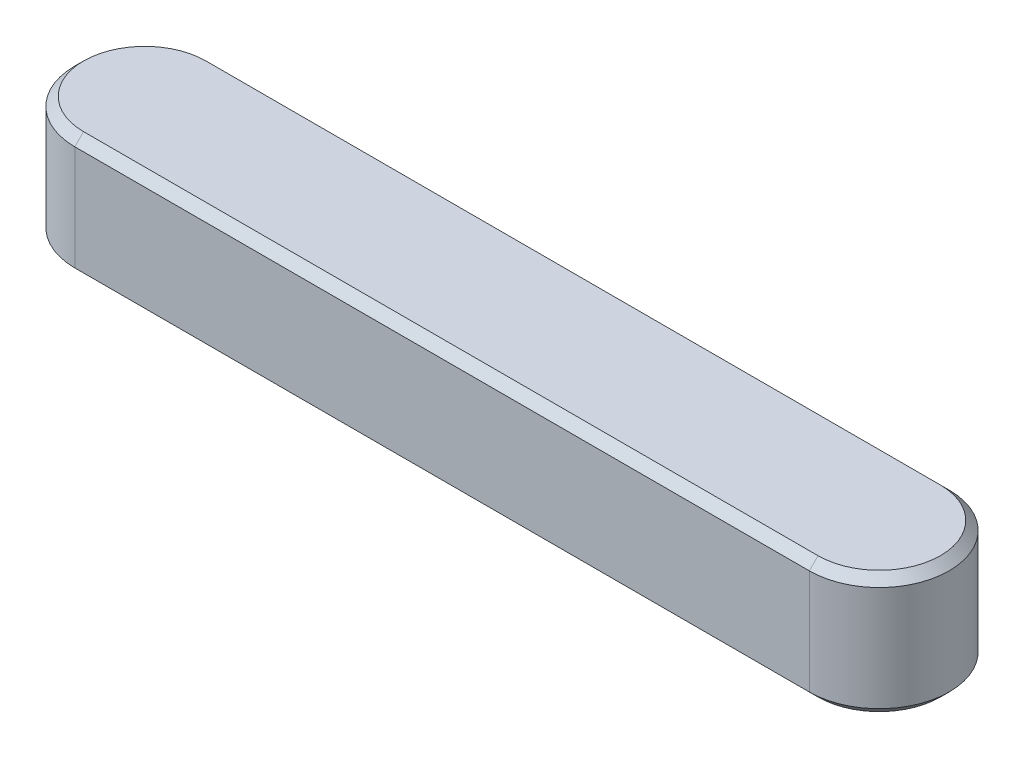
from build123d import *

# Parameters (mm, degrees)
BOSS_EXTRUDE1_DEPTH = 7
CHAMFER1_SIZE       = 0.5


with BuildPart() as part:
    # Sketch1 → Boss-Extrude1 (new body)
    with BuildSketch(Plane(origin=(0, 0, 0), x_dir=(1, 0, 0), z_dir=(0, 1, 0))):
        with BuildLine():
            Line((-21, 4), (21, 4))
            ThreePointArc((21, 4), (25, 0), (21, -4))
            Line((21, -4), (-21, -4))
            ThreePointArc((-21, -4), (-25, 0), (-21, 4))
        make_face()
    extrude(amount=BOSS_EXTRUDE1_DEPTH)

    # Chamfer1
    chamfer1_edges = [part.edges().sort_by_distance(p)[0] for p in [
        (25, 7, 0),
        (0, 7, -4),
        (-25, 7, 0),
        (0, 0, -4),
        (25, 0, 0),
        (0, 0, 4),
        (-25, 0, 0),
        (0, 7, 4),
    ]]
    chamfer(chamfer1_edges, length=CHAMFER1_SIZE)


solid = part.part
